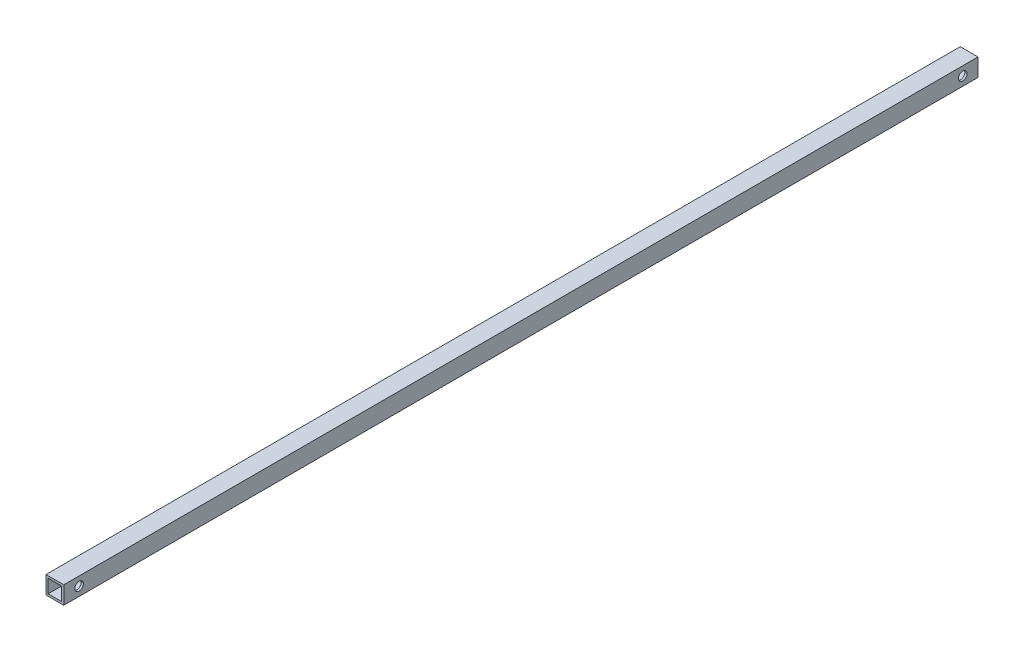
from build123d import *

# Parameters (mm, degrees)
SKETCH_1_W             = 25
SKETCH_1_H             = 25
SKETCH_1_W_2           = 19
SKETCH_1_H_2           = 19
EXTRUDE_1_DEPTH        = 1285.5
SKETCH_6_R             = 6
CUT_EXTRUDE_1_DEPTH    = 3
PATTERN_LINEAR_1_COUNT = 2
PATTERN_LINEAR_1_PITCH = 1242.5


with BuildPart() as part:
    # 草图1 → 拉伸1 (new body)
    with BuildSketch(Plane.XY):
        with Locations((12.5, -12.5)):
            Rectangle(SKETCH_1_W, SKETCH_1_H)
        with Locations((12.5, -12.5)):
            Rectangle(SKETCH_1_W_2, SKETCH_1_H_2, mode=Mode.SUBTRACT)
    extrude(amount=EXTRUDE_1_DEPTH)

    # 草图4 → Ø6.0 (6) 直径孔1 (revolve, cut)
    with BuildSketch(Plane(origin=(0, -12.5, 1264), x_dir=(0, 0, 1), z_dir=(0, 1, 0))):
        Polygon((0, 0), (0, 31.802581857), (3, 30), (3, 0), align=None)
    hole_wizard_6_0_6_1 = revolve(axis=Axis((-6.35, -12.5, 1264), (1, 0, 0)), mode=Mode.SUBTRACT)

    # 草图6 → 切除-拉伸1 (cut)
    with BuildSketch(Plane.ZY.offset(-25)):
        with Locations(Location((1264, -12.5, 0), (0, 0, 270))):
            Circle(SKETCH_6_R)
    cut_extrude_1 = extrude(amount=CUT_EXTRUDE_1_DEPTH, mode=Mode.SUBTRACT)

    # 阵列(线性)1: Ø6.0 (6) 直径孔1, 切除-拉伸1 ×2
    with Locations(*[(0, 0, -i * PATTERN_LINEAR_1_PITCH) for i in range(1, PATTERN_LINEAR_1_COUNT)]):
        add(hole_wizard_6_0_6_1, mode=Mode.SUBTRACT)
        add(cut_extrude_1, mode=Mode.SUBTRACT)


solid = part.part
